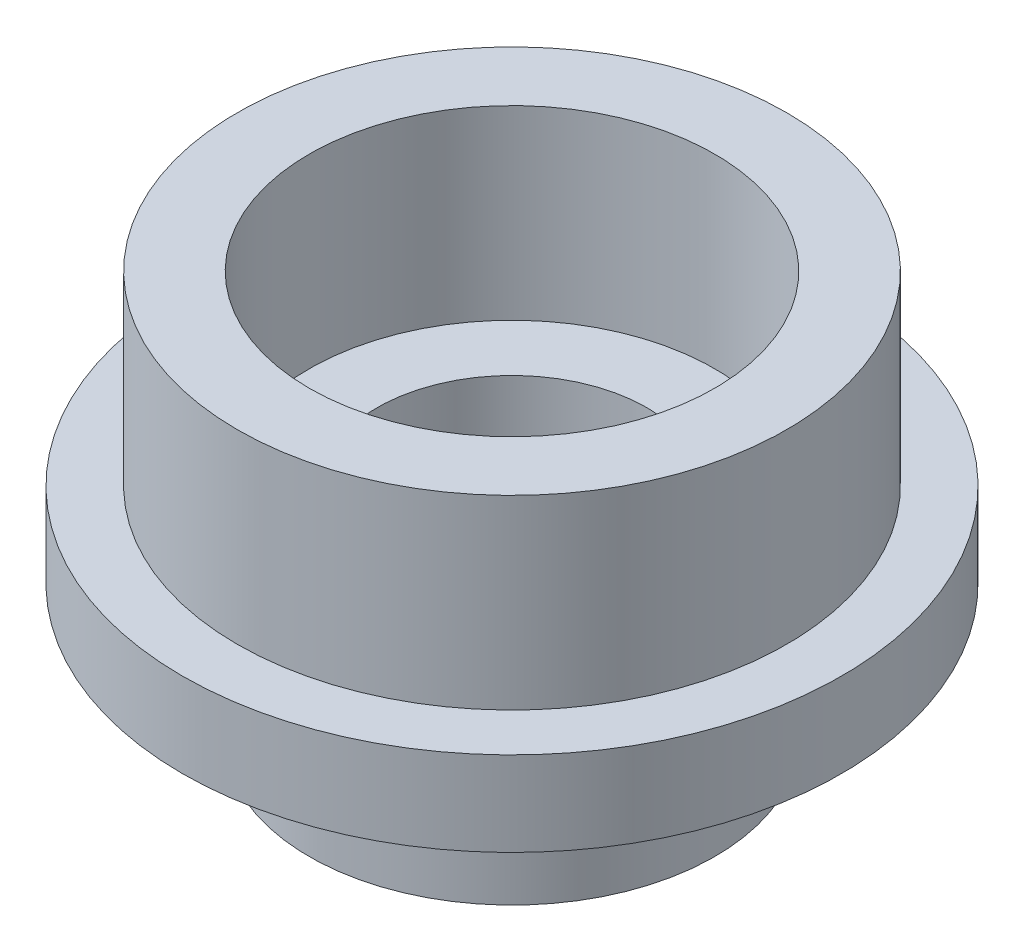
from build123d import *

# Parameters (mm, degrees)
SKETCH1_R           = 3.25
SKETCH1_R_2         = 2.4
BOSS_EXTRUDE1_DEPTH = 2.2
SKETCH2_R           = 3.9
BOSS_EXTRUDE2_DEPTH = 1
BOSS_EXTRUDE3_START = 1.6
SKETCH3_R           = 2.4
SKETCH3_R_2         = 1.6
BOSS_EXTRUDE3_DEPTH = 1.6
SKETCH4_R           = 1.6
CUT_EXTRUDE1_DEPTH  = 7.376519427


with BuildPart() as part:
    # Sketch1 → Boss-Extrude1 (new body)
    with BuildSketch(Plane(origin=(0, 0, 0), x_dir=(1, 0, 0), z_dir=(0, 1, 0))):
        with Locations(Location((0, 0, 0), (0, 0, 270))):
            Circle(SKETCH1_R)
        with Locations(Location((0, 0, 0), (0, 0, 270))):
            Circle(SKETCH1_R_2, mode=Mode.SUBTRACT)
    extrude(amount=BOSS_EXTRUDE1_DEPTH)

    # Sketch2 → Boss-Extrude2 (add)
    with BuildSketch(Plane.XZ):
        with Locations(Location((0, 0, 0), (0, 0, 270))):
            Circle(SKETCH2_R)
    extrude(amount=BOSS_EXTRUDE2_DEPTH)

    # Sketch3 → Boss-Extrude3 (add)
    with BuildSketch(Plane.XZ.offset(1).offset(BOSS_EXTRUDE3_START)):
        with Locations(Location((0, 0, 0), (0, 0, 90))):
            Circle(SKETCH3_R)
        with Locations(Location((0, 0, 0), (0, 0, 270))):
            Circle(SKETCH3_R_2, mode=Mode.SUBTRACT)
    extrude(amount=-BOSS_EXTRUDE3_DEPTH)

    # Sketch4 → Cut-Extrude1 (cut, through all)
    with BuildSketch(Plane.XZ.offset(1)):
        with Locations(Location((0, 0, 0), (0, 0, 270))):
            Circle(SKETCH4_R)
    extrude(amount=-CUT_EXTRUDE1_DEPTH, mode=Mode.SUBTRACT)


solid = part.part
